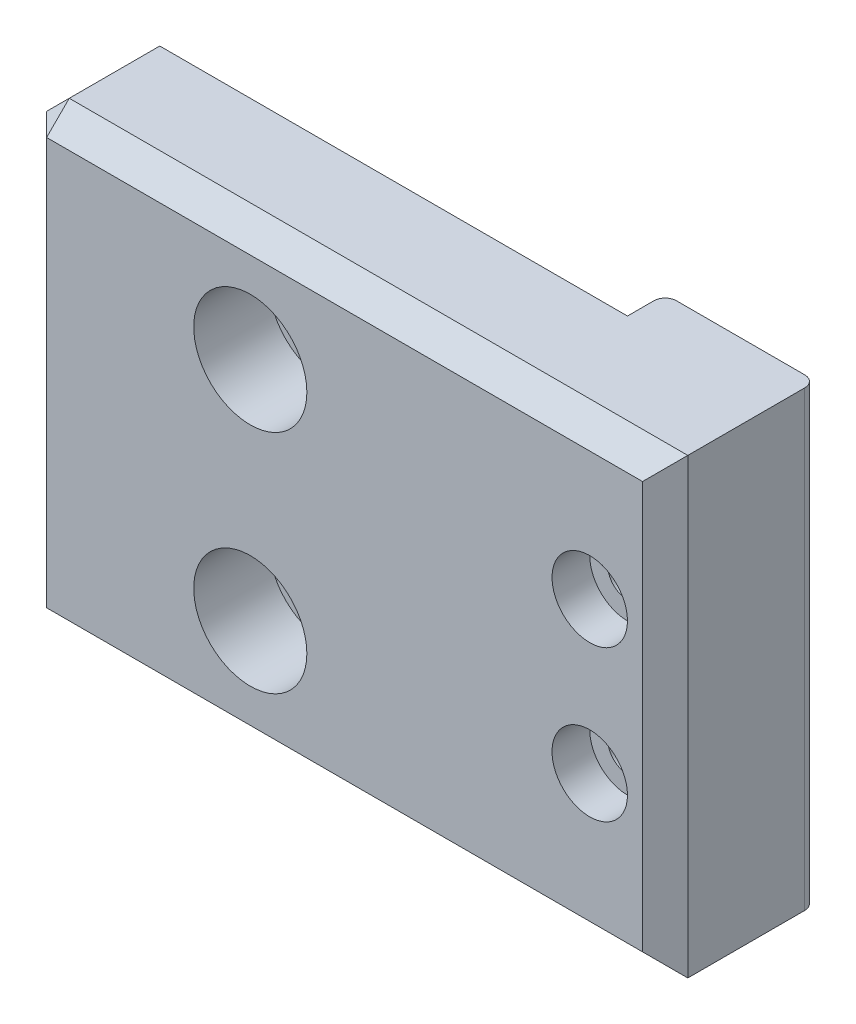
from build123d import *

# Parameters (mm, degrees)
SKETCH1_W               = 85
SKETCH1_H               = 60
BOSS_EXTRUDE1_DEPTH     = 15
SKETCH2_W               = 20
SKETCH2_H               = 60
BOSS_EXTRUDE2_DEPTH     = 5
CUT_EXTRUDE1_DEPTH      = 106.118980208
CUT_EXTRUDE1_DEPTH_BACK = 106.118980208
SKETCH3_R               = 2.6
CUT_EXTRUDE2_START      = 15
SKETCH4_R               = 5
CUT_EXTRUDE2_DEPTH      = 5
FILLET1_R               = 1.5
CUT_EXTRUDE3_DEPTH      = 106.118980208
CUT_EXTRUDE3_DEPTH_BACK = 106.118980208
SKETCH5_R               = 4.1
CUT_EXTRUDE4_START      = 15
SKETCH6_R               = 7.5
CUT_EXTRUDE4_DEPTH      = 10
CHAMFER1_SIZE           = 3


with BuildPart() as part:
    # Sketch1 → Boss-Extrude1 (new body)
    with BuildSketch(Plane.XY):
        with Locations((-42.5, 30)):
            Rectangle(SKETCH1_W, SKETCH1_H)
    extrude(amount=BOSS_EXTRUDE1_DEPTH)

    # Sketch2 → Boss-Extrude2 (add)
    with BuildSketch(Plane.XY):
        with Locations((-10, 30)):
            Rectangle(SKETCH2_W, SKETCH2_H)
    extrude(amount=-BOSS_EXTRUDE2_DEPTH)

    # Sketch3 → Cut-Extrude1 (cut, two sides: drawn at the far end of the back side and taken through both)
    with BuildSketch(Plane.XY.offset(-CUT_EXTRUDE1_DEPTH_BACK)):
        with Locations((-10, 40)):
            Circle(SKETCH3_R)
        with Locations((-10, 20)):
            Circle(SKETCH3_R)
    extrude(amount=CUT_EXTRUDE1_DEPTH + CUT_EXTRUDE1_DEPTH_BACK, mode=Mode.SUBTRACT)

    # Sketch4 → Cut-Extrude2 (cut)
    with BuildSketch(Plane.XY.offset(CUT_EXTRUDE2_START)):
        with Locations((-10, 40)):
            Circle(SKETCH4_R)
        with Locations((-10, 20)):
            Circle(SKETCH4_R)
    extrude(amount=-CUT_EXTRUDE2_DEPTH, mode=Mode.SUBTRACT)

    # Fillet1
    fillet1_edges = [part.edges().sort_by_distance(p)[0] for p in [
        (-20, 30, -5),
        (0, 30, -5),
    ]]
    fillet(fillet1_edges, radius=FILLET1_R)

    # Sketch5 → Cut-Extrude3 (cut, two sides: drawn at the far end of the back side and taken through both)
    with BuildSketch(Plane.XY.offset(-CUT_EXTRUDE3_DEPTH_BACK)):
        with Locations((-55, 45)):
            Circle(SKETCH5_R)
        with Locations((-55, 15)):
            Circle(SKETCH5_R)
    extrude(amount=CUT_EXTRUDE3_DEPTH + CUT_EXTRUDE3_DEPTH_BACK, mode=Mode.SUBTRACT)

    # Sketch6 → Cut-Extrude4 (cut)
    with BuildSketch(Plane.XY.offset(CUT_EXTRUDE4_START)):
        with Locations((-55, 45)):
            Circle(SKETCH6_R)
        with Locations((-55, 15)):
            Circle(SKETCH6_R)
    extrude(amount=-CUT_EXTRUDE4_DEPTH, mode=Mode.SUBTRACT)

    # Chamfer1
    chamfer1_edges = [part.edges().sort_by_distance(p)[0] for p in [
        (-42.5, 60, 15),
        (-85, 30, 15),
        (-42.5, 0, 15),
        (-85, 0, 7.5),
        (-85, 60, 7.5),
        (0, 30, 15),
    ]]
    chamfer(chamfer1_edges, length=CHAMFER1_SIZE)


solid = part.part
